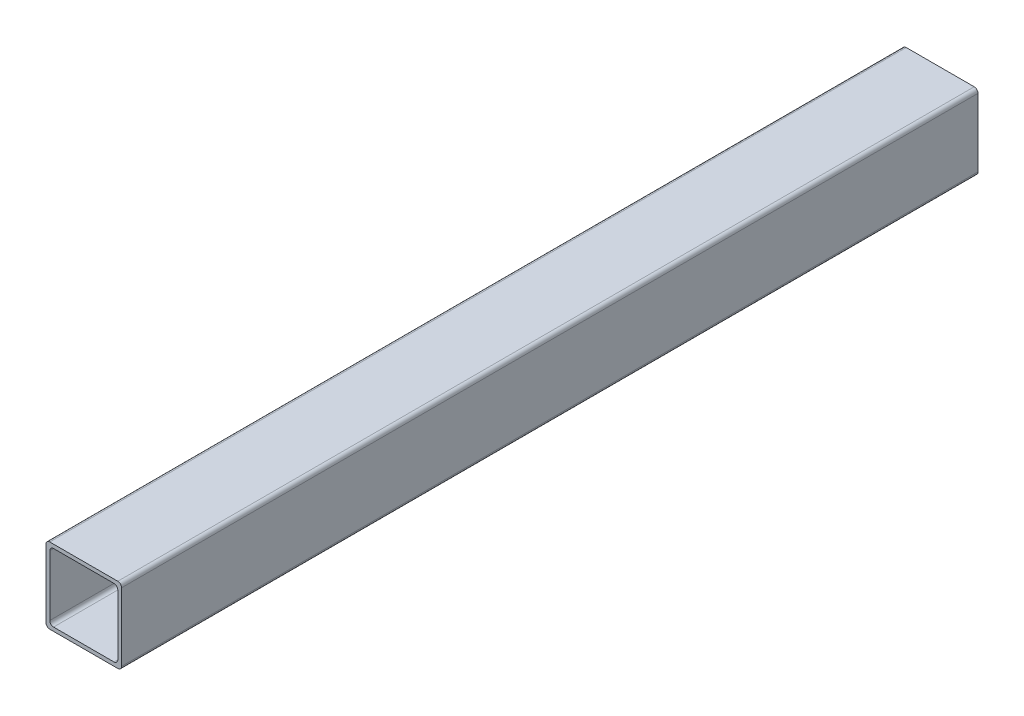
from build123d import *

# Parameters (mm, degrees)
DODANIE_WYCI_GNI_CIE1_DEPTH = 680


with BuildPart() as part:
    # Szkic1 → Dodanie-wyciągnięcie1 (new body)
    with BuildSketch(Plane.XY):
        with BuildLine():
            ThreePointArc((0, 57), (0.878679656, 59.121320344), (3, 60))
            Line((3, 60), (57, 60))
            ThreePointArc((57, 60), (59.121320344, 59.121320344), (60, 57))
            Line((60, 57), (60, 3))
            ThreePointArc((60, 3), (59.121320344, 0.878679656), (57, 0))
            Line((57, 0), (3, 0))
            ThreePointArc((3, 0), (0.878679656, 0.878679656), (0, 3))
            Line((0, 3), (0, 57))
        make_face()
        with BuildLine():
            Line((3, 6), (3, 54))
            ThreePointArc((3, 54), (3.878679656, 56.121320344), (6, 57))
            Line((6, 57), (54, 57))
            ThreePointArc((54, 57), (56.121320344, 56.121320344), (57, 54))
            Line((57, 54), (57, 6))
            ThreePointArc((57, 6), (56.121320344, 3.878679656), (54, 3))
            Line((54, 3), (6, 3))
            ThreePointArc((6, 3), (3.878679656, 3.878679656), (3, 6))
        make_face(mode=Mode.SUBTRACT)
    extrude(amount=DODANIE_WYCI_GNI_CIE1_DEPTH)


solid = part.part
